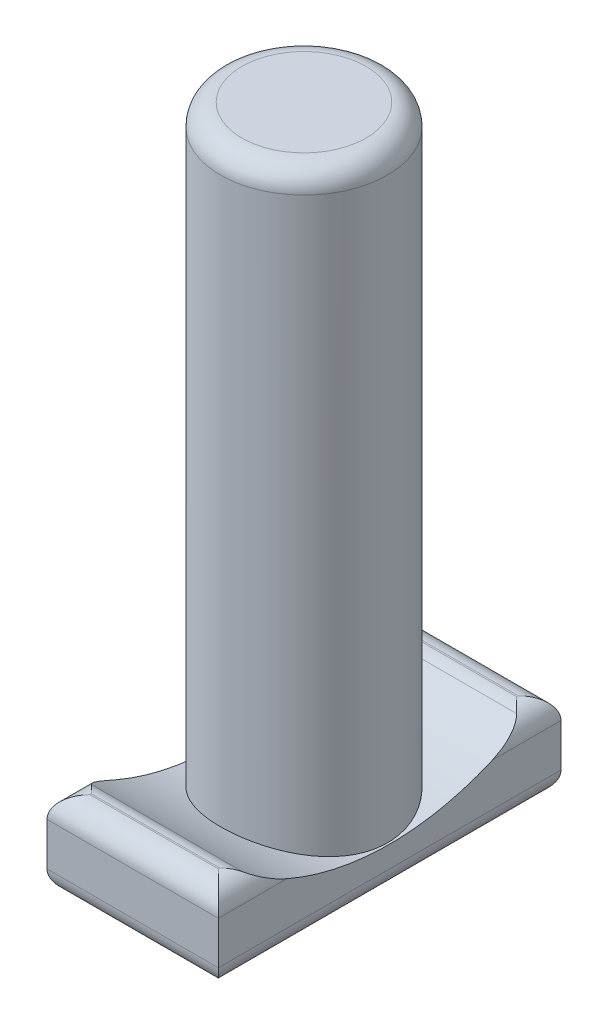
from build123d import *

# Parameters (mm, degrees)
SKETCH_1_W          = 4
SKETCH_1_H          = 8
SKETCH_1_R          = 1.95
EXTRUDE_1_DEPTH     = 2
SKETCH_3_R          = 6
CUT_EXTRUDE_1_DEPTH = 10.16515139
SKETCH_2_R          = 1.95
EXTRUDE_3_DEPTH     = 15
FILLET_3_R          = 0.5


with BuildPart() as part:
    # 草图1 → 凸台-拉伸1 (new body)
    with BuildSketch(Plane(origin=(0, 0, 0), x_dir=(1, 0, 0), z_dir=(0, 1, 0))):
        with Locations((2, 4)):
            Rectangle(SKETCH_1_W, SKETCH_1_H)
        with Locations(Location((2, 4, 0), (0, 0, 270))):
            Circle(SKETCH_1_R, mode=Mode.SUBTRACT)
    extrude(amount=EXTRUDE_1_DEPTH)

    # 草图3 → 切除-拉伸1 (cut, through all)
    with BuildSketch(Plane.ZY):
        with Locations((-4, 7)):
            Circle(SKETCH_3_R)
    extrude(amount=-CUT_EXTRUDE_1_DEPTH, mode=Mode.SUBTRACT)

    # 草图2 → 凸台-拉伸3 (add)
    with BuildSketch(Plane.XZ):
        with Locations(Location((2, -4, 0), (0, 0, 270))):
            Circle(SKETCH_2_R)
    extrude(amount=-EXTRUDE_3_DEPTH)

    # 圆角3
    fillet_3_edges = [part.edges().sort_by_distance(p)[0] for p in [
        (4, 2, -0.341687605),
        (2, 2, -8),
        (4, 2, -7.658312395),
        (0, 2, -0.341687605),
        (2, 2, -0.68337521),
        (2, 2, -7.31662479),
        (2, 15, -2.05),
        (0, 2, -7.658312395),
        (2, 0, -8),
        (4, 0, -4),
        (2, 0, 0),
        (0, 0, -4),
        (2, 2, 0),
    ]]
    fillet(fillet_3_edges, radius=FILLET_3_R)


solid = part.part
